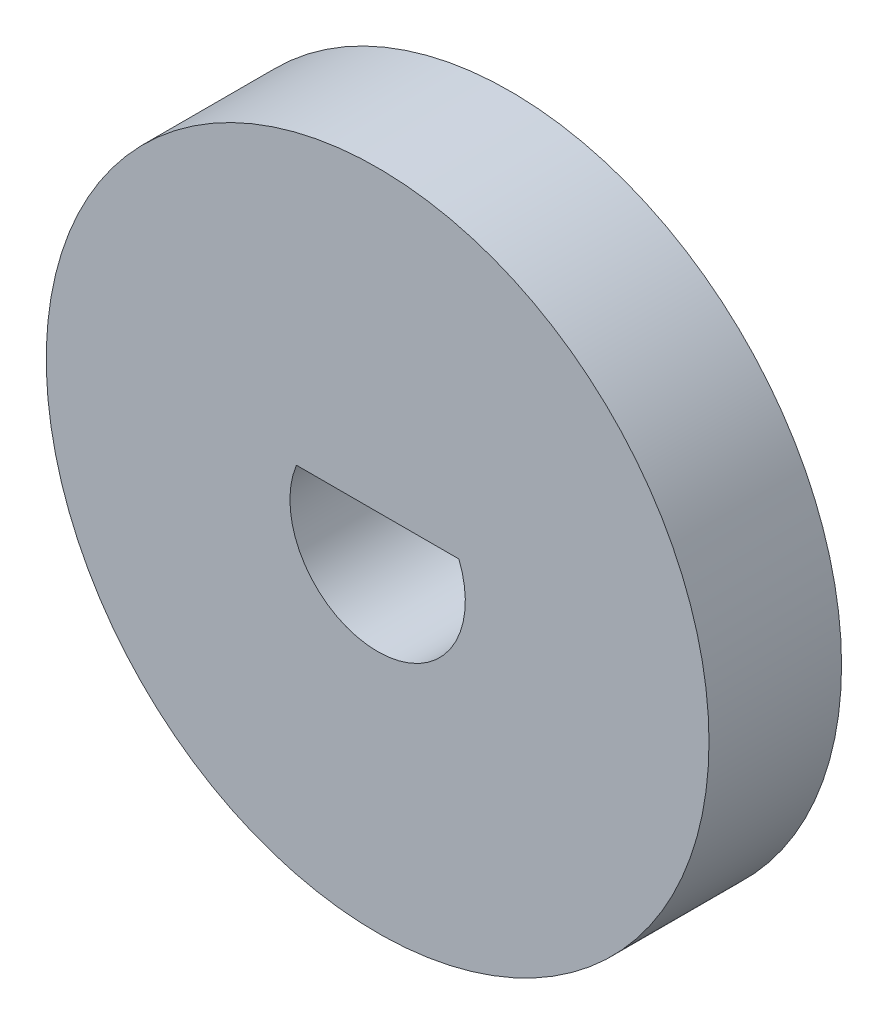
from build123d import *

# Parameters (mm, degrees)
SKETCH_1_R      = 20
EXTRUDE_1_DEPTH = 8


with BuildPart() as part:
    # 草图1 → 凸台-拉伸1 (new body)
    with BuildSketch(Plane.XY):
        Circle(SKETCH_1_R)
        with BuildLine():
            Line((4.9, 2), (-4.9, 2))
            ThreePointArc((-4.9, 2), (0, -5.292447449), (4.9, 2))
        make_face(mode=Mode.SUBTRACT)
    extrude(amount=EXTRUDE_1_DEPTH)


solid = part.part
